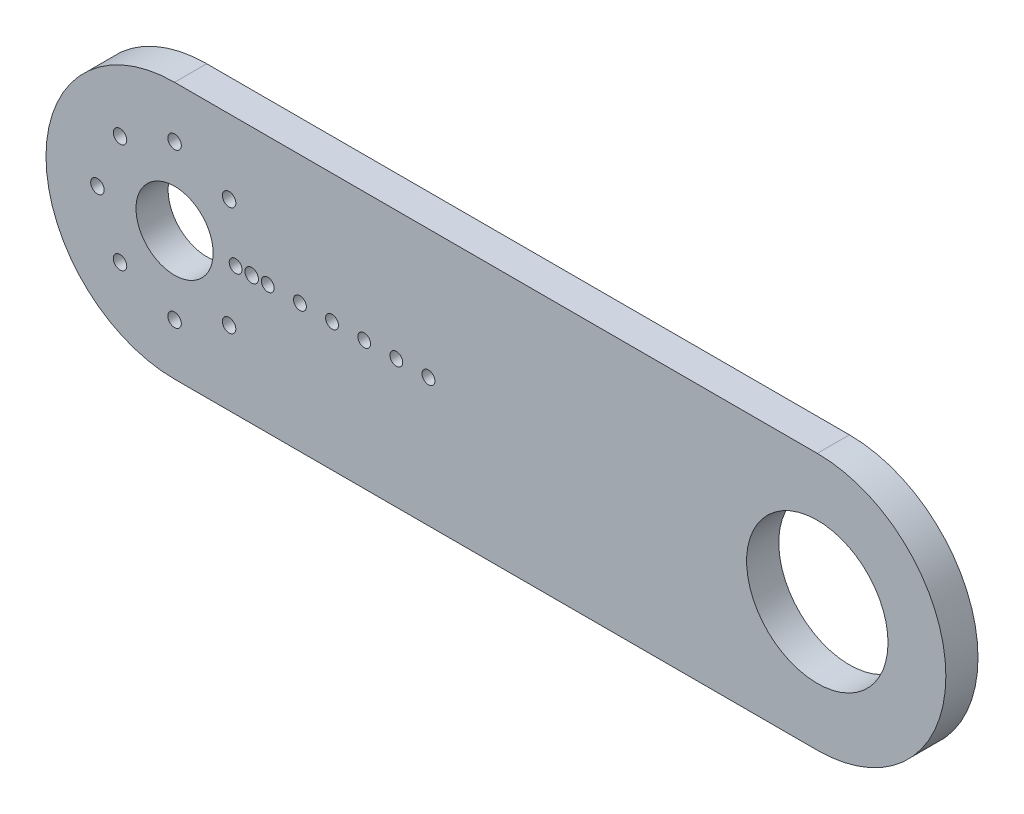
from build123d import *

# Parameters (mm, degrees)
SKETCH1_R           = 6
SKETCH1_R_2         = 1
SKETCH1_R_3         = 11
SKETCH1_R_4         = 1.05
BOSS_EXTRUDE1_DEPTH = 2.5


with BuildPart() as part:
    # Sketch1 → Boss-Extrude1 (new, symmetric)
    with BuildSketch(Plane.XY):
        with BuildLine():
            Line((0, 20), (100, 20))
            ThreePointArc((100, 20), (120, 0), (100, -20))
            Line((100, -20), (0, -20))
            ThreePointArc((0, -20), (-20, 0), (0, 20))
        make_face()
        Circle(SKETCH1_R, mode=Mode.SUBTRACT)
        with Locations((9.5, 0)):
            Circle(SKETCH1_R_2, mode=Mode.SUBTRACT)
        with Locations((14.5, 0)):
            Circle(SKETCH1_R_2, mode=Mode.SUBTRACT)
        with Locations((19.5, 0)):
            Circle(SKETCH1_R_2, mode=Mode.SUBTRACT)
        with Locations((24.5, 0)):
            Circle(SKETCH1_R_2, mode=Mode.SUBTRACT)
        with Locations((29.5, 0)):
            Circle(SKETCH1_R_2, mode=Mode.SUBTRACT)
        with Locations((34.5, 0)):
            Circle(SKETCH1_R_2, mode=Mode.SUBTRACT)
        with Locations((39.5, 0)):
            Circle(SKETCH1_R_2, mode=Mode.SUBTRACT)
        with Locations((100, 0)):
            Circle(SKETCH1_R_3, mode=Mode.SUBTRACT)
        with Locations((0, 12)):
            Circle(SKETCH1_R_4, mode=Mode.SUBTRACT)
        with Locations((8.485281374, 8.485281374)):
            Circle(SKETCH1_R_4, mode=Mode.SUBTRACT)
        with Locations((12, 0)):
            Circle(SKETCH1_R_4, mode=Mode.SUBTRACT)
        with Locations((8.485281374, -8.485281374)):
            Circle(SKETCH1_R_4, mode=Mode.SUBTRACT)
        with Locations((0, -12)):
            Circle(SKETCH1_R_4, mode=Mode.SUBTRACT)
        with Locations((-8.485281374, -8.485281374)):
            Circle(SKETCH1_R_4, mode=Mode.SUBTRACT)
        with Locations((-12, 0)):
            Circle(SKETCH1_R_4, mode=Mode.SUBTRACT)
        with Locations((-8.485281374, 8.485281374)):
            Circle(SKETCH1_R_4, mode=Mode.SUBTRACT)
    extrude(amount=BOSS_EXTRUDE1_DEPTH, both=True)


solid = part.part
